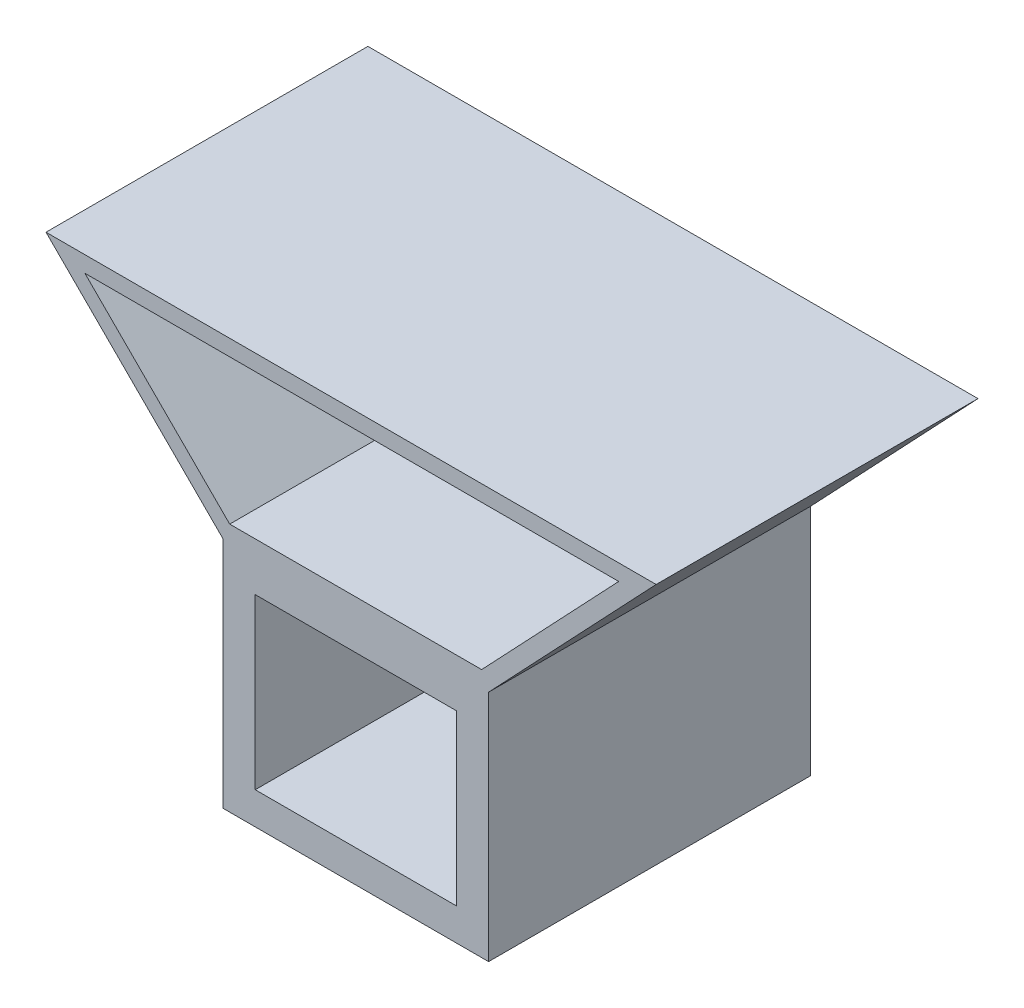
from build123d import *

# Parameters (mm, degrees)
SKETCH1_W           = 16.5
SKETCH1_H           = 14.5
SKETCH1_W_2         = 12.5
SKETCH1_H_2         = 10.5
BOSS_EXTRUDE1_DEPTH = 20
BOSS_EXTRUDE2_DEPTH = 20


with BuildPart() as part:
    # Sketch1 → Boss-Extrude1 (new body)
    with BuildSketch(Plane.XY):
        with Locations((6.25, 5.25)):
            Rectangle(SKETCH1_W, SKETCH1_H)
        with Locations((6.25, 5.25)):
            Rectangle(SKETCH1_W_2, SKETCH1_H_2, mode=Mode.SUBTRACT)
    extrude(amount=BOSS_EXTRUDE1_DEPTH)

    # Sketch2 → Boss-Extrude2 (add)
    with BuildSketch(Plane(origin=(0, 0, 0), x_dir=(-1, 0, 0), z_dir=(0, 0, -1))):
        Polygon((2, 12.5), (13, 23.5), (-24.907922473, 23.5), (-14.5, 12.5), align=None)
        Polygon((-22.585068112, 22.5), (-14.069495179, 13.5), (1.585786438, 13.5), (10.585786438, 22.5), align=None, mode=Mode.SUBTRACT)
    extrude(amount=-BOSS_EXTRUDE2_DEPTH)


solid = part.part
